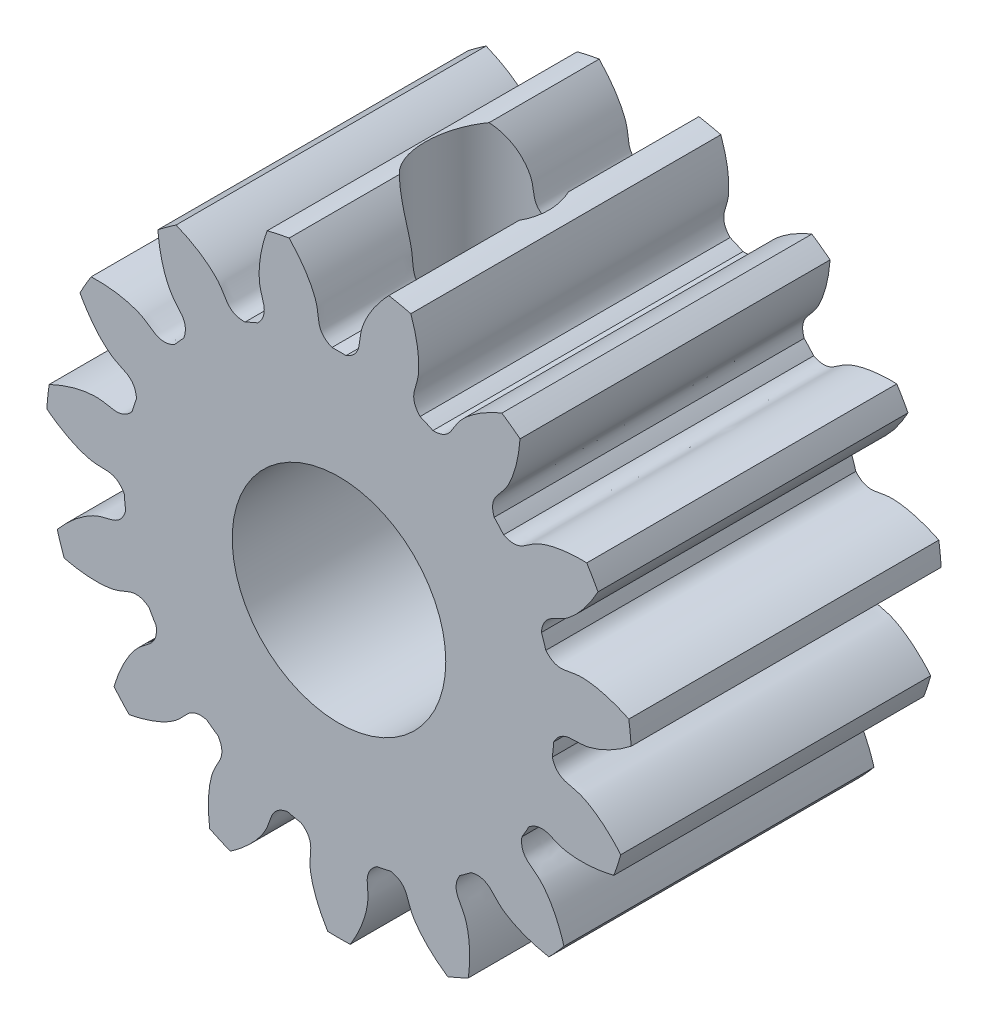
from build123d import *

# Parameters (mm, degrees)
SKETCH_1_R               = 4.25
EXTRUDE_1_DEPTH          = 4.5
CUT_EXTRUDE_1_DEPTH      = 8.508328709
PATTERN_CIRCULAR_1_COUNT = 15
CUT_EXTRUDE_2_REACH      = 9.503
SKETCH_4_R               = 1.55
CUT_EXTRUDE_START        = 4.2
SKETCH_5_R               = 0.9
CUT_EXTRUDE_3_DEPTH      = 2
CUT_EXTRUDE_4_REACH      = 10.935
CUT_EXTRUDE_4_END_RADIUS = 1.55
SKETCH_6_R               = 0.5


with BuildPart() as part:
    # 草图1 → 凸台-拉伸1 (new body)
    with BuildSketch(Plane.XY):
        Circle(SKETCH_1_R)
    extrude(amount=EXTRUDE_1_DEPTH)

    # 草图2 → 切除-拉伸1 (cut, through all)
    with BuildSketch(Plane.XY):
        with BuildLine():
            ThreePointArc((0.102142521, 3.123330259), (0, 3.125), (-0.102142521, 3.123330259))
            add(Edge.make_bspline(
                [(-0.102142521, 3.123330259), (-0.328606529, 3.217205114), (-0.286056567, 3.393164711), (-0.325630243, 3.554251883), (-0.328716589, 3.565829148), (-0.332424424, 3.578696912), (-0.336805119, 3.592834652), (-0.341911201, 3.608219988), (-0.347794015, 3.624829049), (-0.354504401, 3.642636383), (-0.362092429, 3.661615009), (-0.370607425, 3.68173642), (-0.380097912, 3.702970613), (-0.390611575, 3.725286105), (-0.402195217, 3.748649954), (-0.414894726, 3.773027785), (-0.42875503, 3.798383812), (-0.443820065, 3.824680861), (-0.460132732, 3.851880399), (-0.477734865, 3.87994256), (-0.496667191, 3.908826169), (-0.516969298, 3.938488777), (-0.538679598, 3.968886682), (-0.561835294, 3.999974966), (-0.586472345, 4.031707525), (-0.612625439, 4.064037097), (-0.640327952, 4.096915299), (-0.669611928, 4.130292659), (-0.70050804, 4.164118648), (-0.733045564, 4.198341721), (-0.767252353, 4.232909346), (-0.803154806, 4.267768045), (-0.840777842, 4.30286343), (-0.880144878, 4.33814024), (-0.921277797, 4.373542382), (-0.964196933, 4.409012967), (-1.008921041, 4.444494353), (-1.055467278, 4.479928182), (-1.103851182, 4.515255425), (-1.154086653, 4.550416421), (-1.206185932, 4.585350919), (-1.260159587, 4.619998121), (-1.316016488, 4.654296726), (-1.373763805, 4.688184973), (-1.433406971, 4.721600685), (-1.516292831, 4.765884352), (-1.580075957, 4.797516983), (-1.623419194, 4.817964103)],
                knots=[0, 0, 0, 0, 0.202473101, 0.206978902, 0.212085478, 0.217792827, 0.224100949, 0.231009845, 0.238519514, 0.246629958, 0.255341174, 0.264653164, 0.274565928, 0.285079465, 0.296193776, 0.307908861, 0.320224719, 0.33314135, 0.346658755, 0.360776934, 0.375495886, 0.390815612, 0.406736111, 0.423257384, 0.440379431, 0.458102251, 0.476425844, 0.495350211, 0.514875352, 0.535001266, 0.555727954, 0.577055415, 0.59898365, 0.621512658, 0.64464244, 0.668372996, 0.692704325, 0.717636428, 0.743169304, 0.769302954, 0.796037377, 0.823372574, 0.851308544, 0.879845288, 0.908982806, 0.938721097, 1, 1, 1, 1], degree=3))
            ThreePointArc((-1.623419194, 4.817964103), (0, 5.084119194), (1.623419194, 4.817964103))
            add(Edge.make_bspline(
                [(0.102142521, 3.123330259), (0.328606529, 3.217205114), (0.286056567, 3.393164711), (0.325630243, 3.554251883), (0.328716589, 3.565829148), (0.332424424, 3.578696912), (0.336805119, 3.592834652), (0.341911201, 3.608219988), (0.347794015, 3.624829049), (0.354504401, 3.642636383), (0.362092429, 3.661615009), (0.370607425, 3.68173642), (0.380097912, 3.702970613), (0.390611575, 3.725286105), (0.402195217, 3.748649954), (0.414894726, 3.773027785), (0.42875503, 3.798383812), (0.443820065, 3.824680861), (0.460132732, 3.851880399), (0.477734865, 3.87994256), (0.496667191, 3.908826169), (0.516969298, 3.938488777), (0.538679598, 3.968886682), (0.561835294, 3.999974966), (0.586472345, 4.031707525), (0.612625439, 4.064037097), (0.640327952, 4.096915299), (0.669611928, 4.130292659), (0.70050804, 4.164118648), (0.733045564, 4.198341721), (0.767252353, 4.232909346), (0.803154806, 4.267768045), (0.840777842, 4.30286343), (0.880144878, 4.33814024), (0.921277797, 4.373542382), (0.964196933, 4.409012967), (1.008921041, 4.444494353), (1.055467278, 4.479928182), (1.103851182, 4.515255425), (1.154086653, 4.550416421), (1.206185932, 4.585350919), (1.260159587, 4.619998121), (1.316016488, 4.654296726), (1.373763805, 4.688184973), (1.433406971, 4.721600685), (1.516292831, 4.765884352), (1.580075957, 4.797516983), (1.623419194, 4.817964103)],
                knots=[0, 0, 0, 0, 0.202473101, 0.206978902, 0.212085478, 0.217792827, 0.224100949, 0.231009845, 0.238519514, 0.246629958, 0.255341174, 0.264653164, 0.274565928, 0.285079465, 0.296193776, 0.307908861, 0.320224719, 0.33314135, 0.346658755, 0.360776934, 0.375495886, 0.390815612, 0.406736111, 0.423257384, 0.440379431, 0.458102251, 0.476425844, 0.495350211, 0.514875352, 0.535001266, 0.555727954, 0.577055415, 0.59898365, 0.621512658, 0.64464244, 0.668372996, 0.692704325, 0.717636428, 0.743169304, 0.769302954, 0.796037377, 0.823372574, 0.851308544, 0.879845288, 0.908982806, 0.938721097, 1, 1, 1, 1], degree=3))
        make_face()
    cut_extrude_1 = extrude(amount=CUT_EXTRUDE_1_DEPTH, mode=Mode.SUBTRACT)

    # 阵列(圆周)1: 切除-拉伸1 ×15 about axis
    pattern_circular_1_axis = Axis((0, 0, 4.5), (0, 0, -1))
    for i in range(1, PATTERN_CIRCULAR_1_COUNT):
        add(cut_extrude_1.rotate(pattern_circular_1_axis, i * 360 / PATTERN_CIRCULAR_1_COUNT), mode=Mode.SUBTRACT)

    # 草图4 → 切除-拉伸2 (cut, up to next)
    with BuildSketch(Plane.XY.offset(4.5), mode=Mode.PRIVATE) as cut_extrude_2_sk1:
        Circle(SKETCH_4_R)
    cut_extrude_2_tool1 = extrude(cut_extrude_2_sk1.sketch, amount=-CUT_EXTRUDE_2_REACH, mode=Mode.PRIVATE) & part.part
    add(cut_extrude_2_tool1.solids().sort_by_distance((0, 0, 4.5))[0], mode=Mode.SUBTRACT)

    # 草图5 → 切除-拉伸3 (cut)
    with BuildSketch(Plane(origin=(0, 0, 0), x_dir=(1, 0, 0), z_dir=(0, 1, 0)).offset(CUT_EXTRUDE_START)):
        with Locations(Location((-0.102142521, -2.25, 0), (0, 0, 270))):
            Circle(SKETCH_5_R)
    extrude(amount=-CUT_EXTRUDE_3_DEPTH, mode=Mode.SUBTRACT)

    # 切除-拉伸4: up to this cylinder (the profile starts outside it)
    cut_extrude_4_end = Plane(origin=(0, 0, 2.25), z_dir=(0, 0, 1)) * Cylinder(CUT_EXTRUDE_4_END_RADIUS, 25.97, mode=Mode.PRIVATE)
    # 草图6 → 切除-拉伸4 (cut, up to the surface)
    with BuildSketch(Plane(origin=(0, 2.2, 0), x_dir=(1, 0, 0), z_dir=(0, 1, 0)), mode=Mode.PRIVATE) as cut_extrude_4_sk1:
        with Locations(Location((-0.102142521, -2.25, 0), (0, 0, 270))):
            Circle(SKETCH_6_R)
    cut_extrude_4_tool1 = extrude(cut_extrude_4_sk1.sketch, amount=-CUT_EXTRUDE_4_REACH, mode=Mode.PRIVATE) - cut_extrude_4_end
    add(cut_extrude_4_tool1.solids().sort_by_distance((-0.102143, 2.2, 2.25))[0], mode=Mode.SUBTRACT)


solid = part.part
